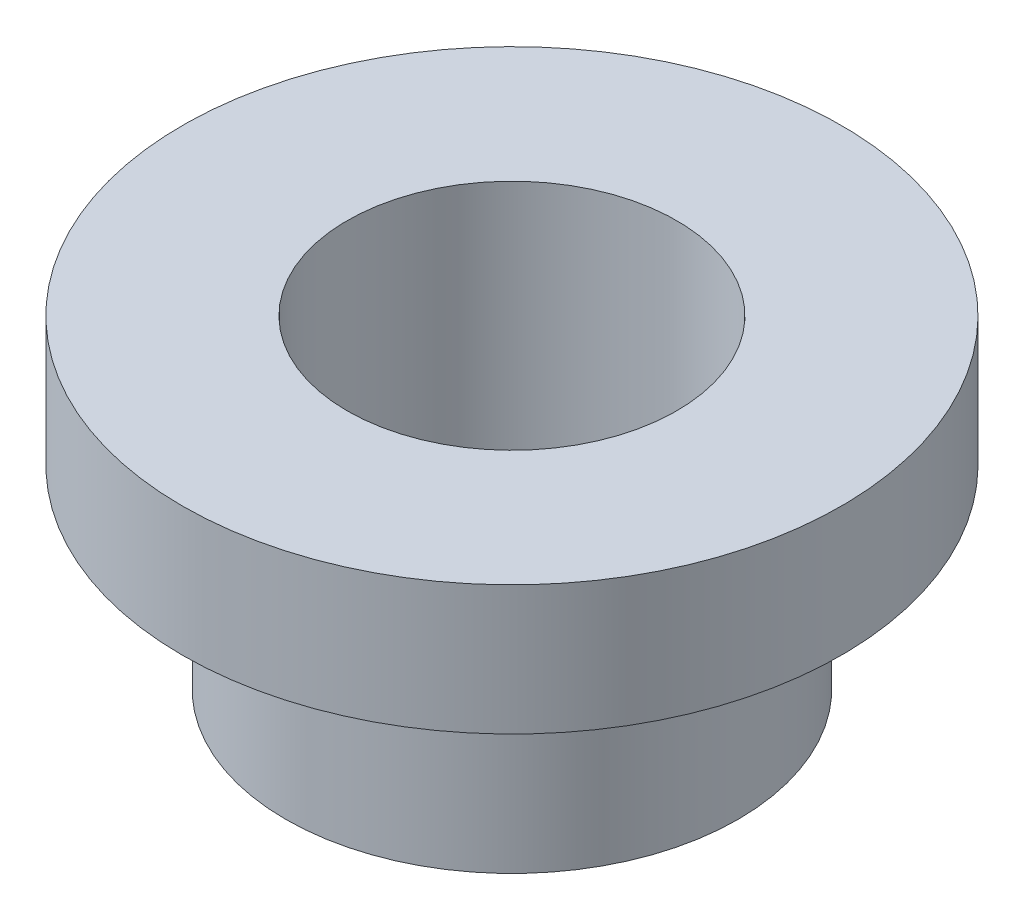
from build123d import *


with BuildPart() as part:
    # Sketch1 → Revolve1 (revolve)
    with BuildSketch(Plane(origin=(0, 0, 0), x_dir=(0, 0, -1), z_dir=(1, 0, 0)), mode=Mode.PRIVATE) as revolve1_sk:
        Polygon((2.55, 2.5), (5.1, 2.5), (5.1, 0.5), (3.5, 0.5), (3.5, -2.5), (2.55, -2.5), align=None)
    revolve(revolve1_sk.sketch.rotate(Axis((0, 8.761716621, 0), (0, -1, 0)), 180), axis=Axis((0, 8.761716621, 0), (0, -1, 0)))


solid = part.part
